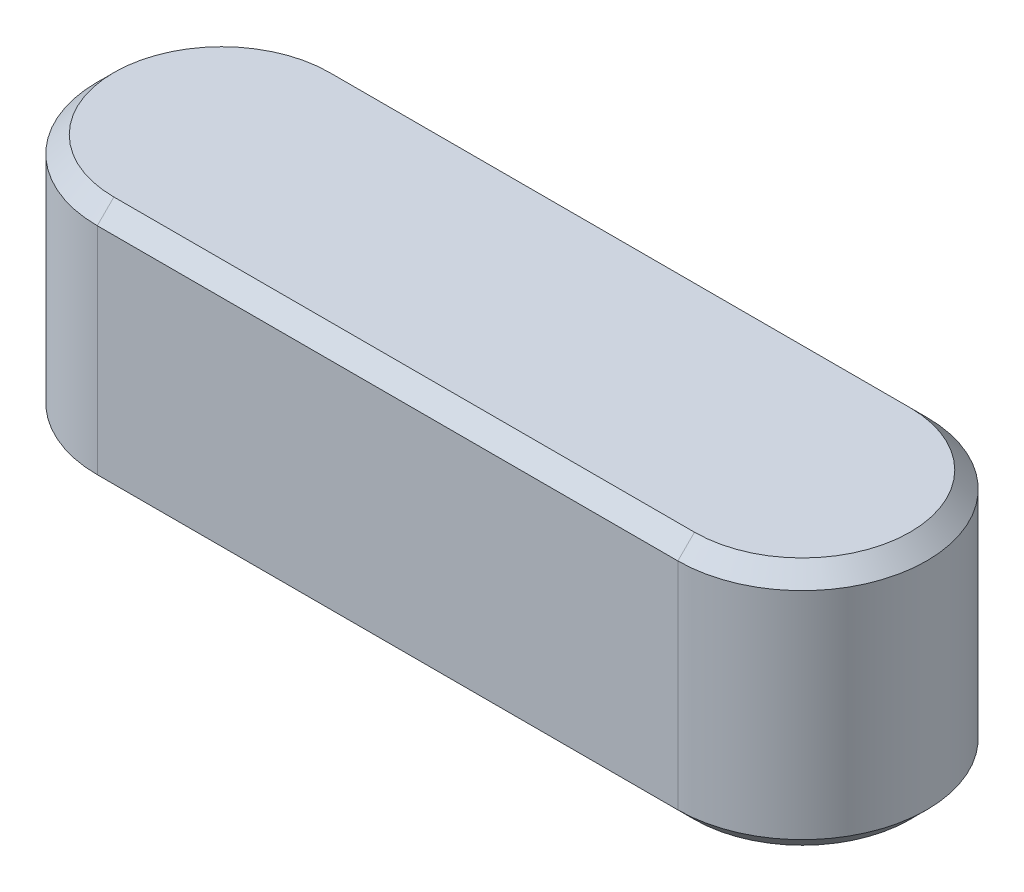
from build123d import *

# Parameters (mm, degrees)
SKETCH1_W           = 10
SKETCH1_H           = 3
BOSS_EXTRUDE1_DEPTH = 3
FILLET1_RADIUS      = 1.5
FILLET1_LENGTH      = 3
FILLET2_RADIUS      = 1.5
FILLET2_LENGTH      = 3
CHAMFER2_SIZE       = 0.2


with BuildPart() as part:
    # Sketch1 → Boss-Extrude1 (new body)
    with BuildSketch(Plane(origin=(0, 0, 0), x_dir=(1, 0, 0), z_dir=(0, 1, 0))):
        Rectangle(SKETCH1_W, SKETCH1_H)
    extrude(amount=BOSS_EXTRUDE1_DEPTH)

    # Fillet1: full round fillet: the end face becomes a half cylinder, R = half its width
    fillet1_face = Plane((-5, 1.5, 0), x_dir=(0, -1, 0), z_dir=(-1, 0, 0))  # on the end face: x along it, z out of the body
    fillet1_slab = fillet1_face.offset(-FILLET1_RADIUS / 2) * Box(FILLET1_LENGTH, 2 * FILLET1_RADIUS, FILLET1_RADIUS, mode=Mode.PRIVATE)  # the body's end, R deep
    fillet1_round = Plane((-3.5, 1.5, 0), x_dir=(-1, 0, 0), z_dir=(0, -1, 0)) * Cylinder(FILLET1_RADIUS, FILLET1_LENGTH, mode=Mode.PRIVATE)  # its axis R under the face
    add(fillet1_slab - fillet1_round, mode=Mode.SUBTRACT)

    # Fillet2: full round fillet: the end face becomes a half cylinder, R = half its width
    fillet2_face = Plane((5, 1.5, 0), x_dir=(0, 1, 0), z_dir=(1, 0, 0))  # on the end face: x along it, z out of the body
    fillet2_slab = fillet2_face.offset(-FILLET2_RADIUS / 2) * Box(FILLET2_LENGTH, 2 * FILLET2_RADIUS, FILLET2_RADIUS, mode=Mode.PRIVATE)  # the body's end, R deep
    fillet2_round = Plane((3.5, 1.5, 0), x_dir=(1, 0, 0), z_dir=(0, 1, 0)) * Cylinder(FILLET2_RADIUS, FILLET2_LENGTH, mode=Mode.PRIVATE)  # its axis R under the face
    add(fillet2_slab - fillet2_round, mode=Mode.SUBTRACT)

    # Chamfer2
    chamfer2_edges = [part.edges().sort_by_distance(p)[0] for p in [
        (0, 0, 1.5),
        (0, 3, 1.5),
        (-5, 3, 0),
        (-5, 0, 0),
        (0, 0, -1.5),
        (0, 3, -1.5),
        (5, 0, 0),
        (5, 3, 0),
    ]]
    chamfer(chamfer2_edges, length=CHAMFER2_SIZE)


solid = part.part
